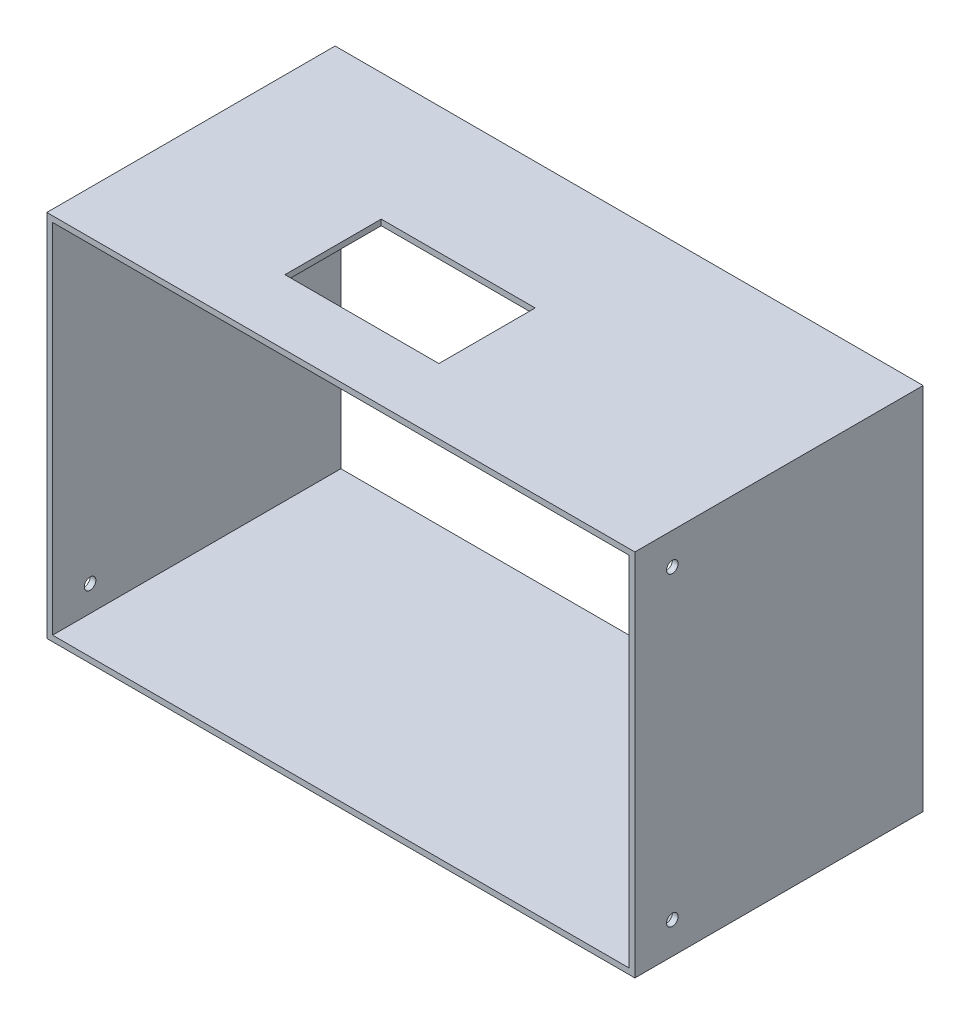
from build123d import *

# Parameters (mm, degrees)
SKETCH_1_W               = 102
SKETCH_1_H               = 64
SKETCH_1_W_2             = 100
SKETCH_1_H_2             = 62
EXTRUDE_1_DEPTH          = 50
CUT_EXTRUDE_2_DEPTH      = 102
CUT_EXTRUDE_2_DEPTH_BACK = 1
SKETCH_5_R               = 1
SKETCH_7_W               = 8.5
SKETCH_7_H               = 8.5
CUT_EXTRUDE_4_DEPTH      = 10
SKETCH_8_W               = 26.7
SKETCH_8_H               = 16.7
CUT_EXTRUDE_5_DEPTH      = 10


with BuildPart() as part:
    # Эскиз1 → Бобышка-Вытянуть1 (new body)
    with BuildSketch(Plane.XY):
        with Locations((53, 34)):
            Rectangle(SKETCH_1_W, SKETCH_1_H)
        with Locations((53, 34)):
            Rectangle(SKETCH_1_W_2, SKETCH_1_H_2, mode=Mode.SUBTRACT)
    extrude(amount=EXTRUDE_1_DEPTH)

    # Эскиз5 → Вырез-Вытянуть2 (cut, two sides: drawn at the far end of the back side and taken through both)
    with BuildSketch(Plane.ZY.offset(-103).offset(-CUT_EXTRUDE_2_DEPTH_BACK)):
        with Locations((43.5, 7.5)):
            Circle(SKETCH_5_R)
        with Locations((43.5, 60.5)):
            Circle(SKETCH_5_R)
    extrude(amount=CUT_EXTRUDE_2_DEPTH + CUT_EXTRUDE_2_DEPTH_BACK, mode=Mode.SUBTRACT)

    # Эскиз7 → Вырез-Вытянуть4 (cut)
    with BuildSketch(Plane.ZY.offset(-2)):
        with Locations((16.25, 56.75)):
            Rectangle(SKETCH_7_W, SKETCH_7_H)
    extrude(amount=-CUT_EXTRUDE_4_DEPTH, mode=Mode.SUBTRACT)

    # Эскиз8 → Вырез-Вытянуть5 (cut)
    with BuildSketch(Plane(origin=(0, 66, 0), x_dir=(1, 0, 0), z_dir=(0, 1, 0))):
        with Locations((45.35, -30.35)):
            Rectangle(SKETCH_8_W, SKETCH_8_H)
    extrude(amount=-CUT_EXTRUDE_5_DEPTH, mode=Mode.SUBTRACT)


solid = part.part
